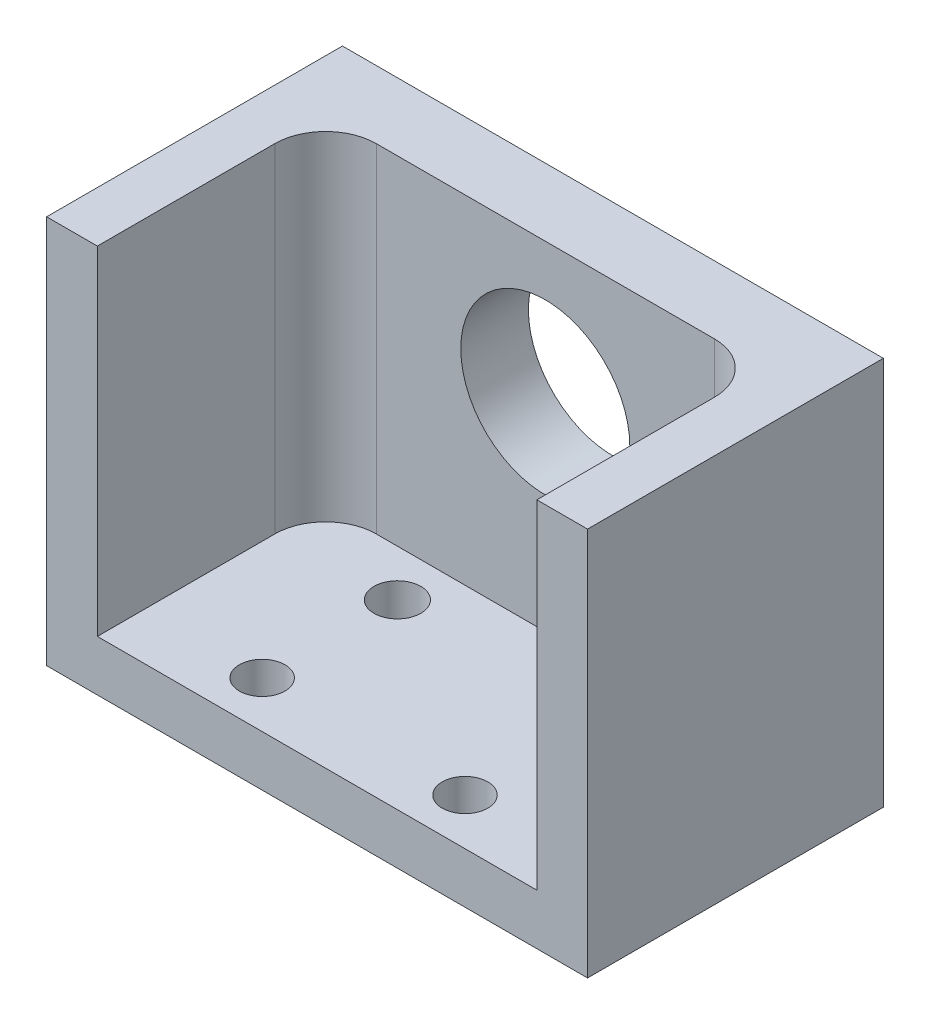
from build123d import *

# Parameters (mm, degrees)
SKETCH_1_W          = 26
SKETCH_1_H          = 17.5
SKETCH_1_R          = 1.385
SKETCH_1_R_2        = 1.35
EXTRUDE_1_DEPTH     = 3
SKETCH_2_W          = 26
SKETCH_2_H          = 4
EXTRUDE_2_DEPTH     = 20
SKETCH_3_R          = 5
CUT_EXTRUDE_1_DEPTH = 20
EXTRUDE_3_DEPTH     = 3
EXTRUDE_4_DEPTH     = 3
EXTRUDE_5_DEPTH     = 3
EXTRUDE_6_DEPTH     = 3
FILLET_1_R          = 3


with BuildPart() as part:
    # 草图1 → 凸台-拉伸1 (new body)
    with BuildSketch(Plane(origin=(0, 0, 0), x_dir=(1, 0, 0), z_dir=(0, 1, 0))):
        Rectangle(SKETCH_1_W, SKETCH_1_H)
        with Locations((-6, 2)):
            Circle(SKETCH_1_R, mode=Mode.SUBTRACT)
        with Locations((-6, -6)):
            Circle(SKETCH_1_R_2, mode=Mode.SUBTRACT)
        with Locations((6, 2)):
            Circle(SKETCH_1_R_2, mode=Mode.SUBTRACT)
        with Locations((6, -6)):
            Circle(SKETCH_1_R_2, mode=Mode.SUBTRACT)
    extrude(amount=EXTRUDE_1_DEPTH)

    # 草图2 → 凸台-拉伸2 (add)
    with BuildSketch(Plane(origin=(0, 3, 0), x_dir=(1, 0, 0), z_dir=(0, 1, 0))):
        with Locations((0, 6.75)):
            Rectangle(SKETCH_2_W, SKETCH_2_H)
    extrude(amount=EXTRUDE_2_DEPTH)

    # 草图3 → 切除-拉伸1 (cut)
    with BuildSketch(Plane.XY.offset(-4.75)):
        with Locations((0, 15)):
            Circle(SKETCH_3_R)
    extrude(amount=-CUT_EXTRUDE_1_DEPTH, mode=Mode.SUBTRACT)

    # 草图4 → 凸台-拉伸3 (add)
    with BuildSketch(Plane.ZY.offset(13)):
        Polygon((-8.75, 23), (-8.75, 0), (8.75, 0), (8.75, 3), (-4.75, 23), align=None)
    extrude(amount=EXTRUDE_3_DEPTH)

    # 草图5 → 凸台-拉伸4 (add)
    with BuildSketch(Plane(origin=(13, 0, 0), x_dir=(0, 0, -1), z_dir=(1, 0, 0))):
        Polygon((8.75, 0), (-8.75, 0), (-8.75, 3), (4.75, 23), (8.75, 23), align=None)
    extrude(amount=EXTRUDE_4_DEPTH)

    # 草图6 → 凸台-拉伸5 (add)
    with BuildSketch(Plane.ZY.offset(16)):
        Polygon((-4.75, 23), (8.75, 23), (8.75, 3), align=None)
    extrude(amount=-EXTRUDE_5_DEPTH)

    # 草图8 → 凸台-拉伸6 (add)
    with BuildSketch(Plane(origin=(16, 0, 0), x_dir=(0, 0, -1), z_dir=(1, 0, 0))):
        Polygon((-8.75, 3), (-8.75, 23), (4.75, 23), align=None)
    extrude(amount=-EXTRUDE_6_DEPTH)

    # 圆角1
    fillet_1_edges = [part.edges().sort_by_distance(p)[0] for p in [
        (-13, 13, -4.75),
        (13, 13, -4.75),
    ]]
    fillet(fillet_1_edges, radius=FILLET_1_R)


solid = part.part
